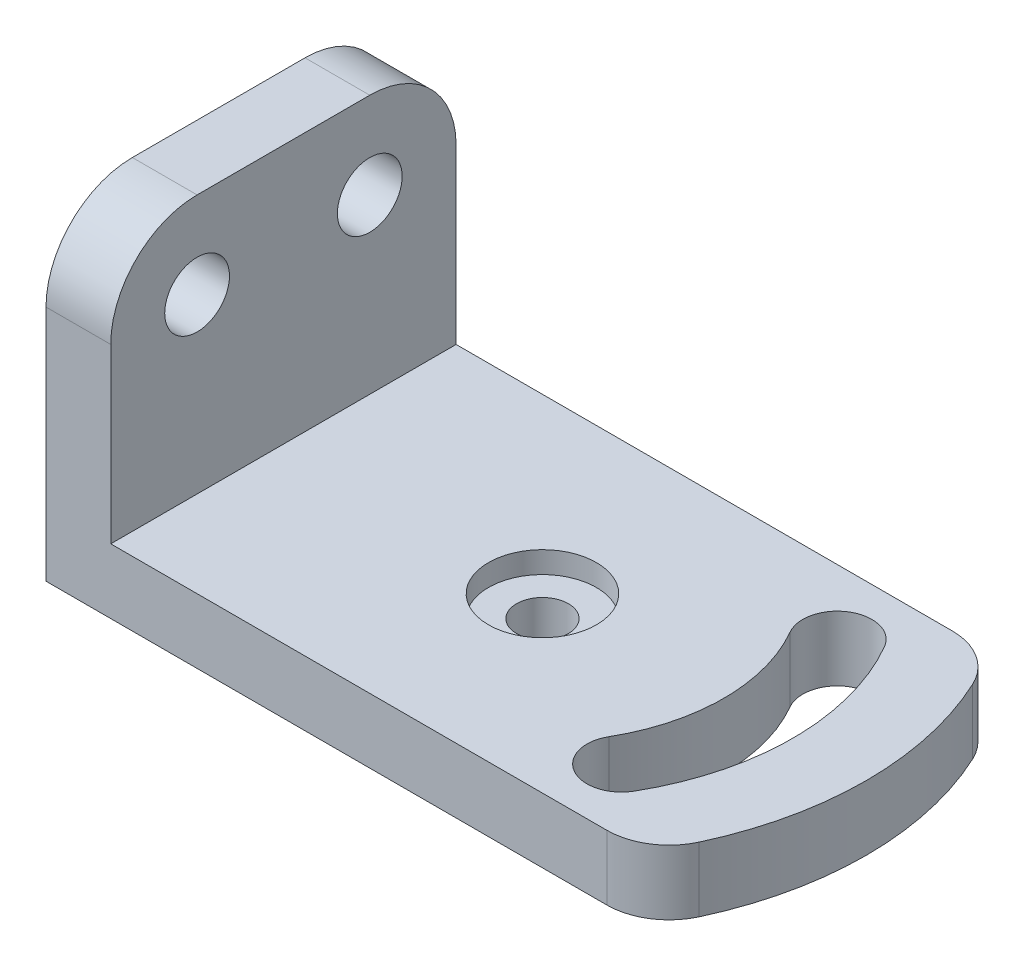
from build123d import *

# Parameters (mm, degrees)
SKETCH1_W               = 15
SKETCH1_H               = 80
BOSS_EXTRUDE1_DEPTH     = 75
SKETCH1_3_R             = 12.5
BOSS_EXTRUDE2_DEPTH     = 15
SKETCH1_4_R             = 12.5
SKETCH1_4_R_2           = 6
BOSS_EXTRUDE3_DEPTH     = 10
CUT_EXTRUDE1_DEPTH      = 160.530561335
CUT_EXTRUDE1_DEPTH_BACK = 160.530561335
SKETCH2_R               = 7.5


with BuildPart() as part:
    # Sketch1 → Boss-Extrude1 (new body)
    with BuildSketch(Plane(origin=(0, 0, 0), x_dir=(1, 0, 0), z_dir=(0, 1, 0))):
        with Locations((7.5, 0)):
            Rectangle(SKETCH1_W, SKETCH1_H)
    extrude(amount=BOSS_EXTRUDE1_DEPTH)

    # Sketch1<3> → Boss-Extrude2 (add)
    with BuildSketch(Plane(origin=(0, 0, 0), x_dir=(1, 0, 0), z_dir=(0, 1, 0))):
        with BuildLine():
            Line((129.928343994, 40), (15, 40))
            Line((15, 40), (15, -40))
            Line((15, -40), (129.928343994, -40))
            ThreePointArc((129.928343994, -40), (137.665581407, -37.744432147), (142.97865308, -31.684424019))
            ThreePointArc((142.97865308, -31.684424019), (150, 0), (142.97865308, 31.684424019))
            ThreePointArc((142.97865308, 31.684424019), (137.665581407, 37.744432147), (129.928343994, 40))
        make_face()
        with Locations((75, 0)):
            Circle(SKETCH1_3_R, mode=Mode.SUBTRACT)
        with BuildLine():
            ThreePointArc((125.229473419, 29), (133, 0), (125.229473419, -29))
            ThreePointArc((125.229473419, -29), (114.301270189, -31.92820323), (111.373066959, -21))
            ThreePointArc((111.373066959, -21), (117, 0), (111.373066959, 21))
            ThreePointArc((111.373066959, 21), (114.301270189, 31.92820323), (125.229473419, 29))
        make_face(mode=Mode.SUBTRACT)
    extrude(amount=BOSS_EXTRUDE2_DEPTH)

    # Sketch1<4> → Boss-Extrude3 (add)
    with BuildSketch(Plane(origin=(0, 0, 0), x_dir=(1, 0, 0), z_dir=(0, 1, 0))):
        with Locations((75, 0)):
            Circle(SKETCH1_4_R)
        with Locations((75, 0)):
            Circle(SKETCH1_4_R_2, mode=Mode.SUBTRACT)
    extrude(amount=BOSS_EXTRUDE3_DEPTH)

    # Sketch2 → Cut-Extrude1 (cut, two sides: drawn at the far end of the back side and taken through both)
    with BuildSketch(Plane(origin=(15, 0, 0), x_dir=(0, 0, -1), z_dir=(1, 0, 0)).offset(-CUT_EXTRUDE1_DEPTH_BACK)):
        with Locations((-20, 55)):
            Circle(SKETCH2_R)
        with BuildLine():
            ThreePointArc((-40, 55), (-34.142135624, 69.142135624), (-20, 75))
            Line((-20, 75), (-40, 75))
            Line((-40, 75), (-40, 55))
        make_face()
        with BuildLine():
            ThreePointArc((20, 75), (34.142135624, 69.142135624), (40, 55))
            Line((40, 55), (40, 75))
            Line((40, 75), (20, 75))
        make_face()
        with Locations((20, 55)):
            Circle(SKETCH2_R)
    extrude(amount=CUT_EXTRUDE1_DEPTH + CUT_EXTRUDE1_DEPTH_BACK, mode=Mode.SUBTRACT)


solid = part.part
